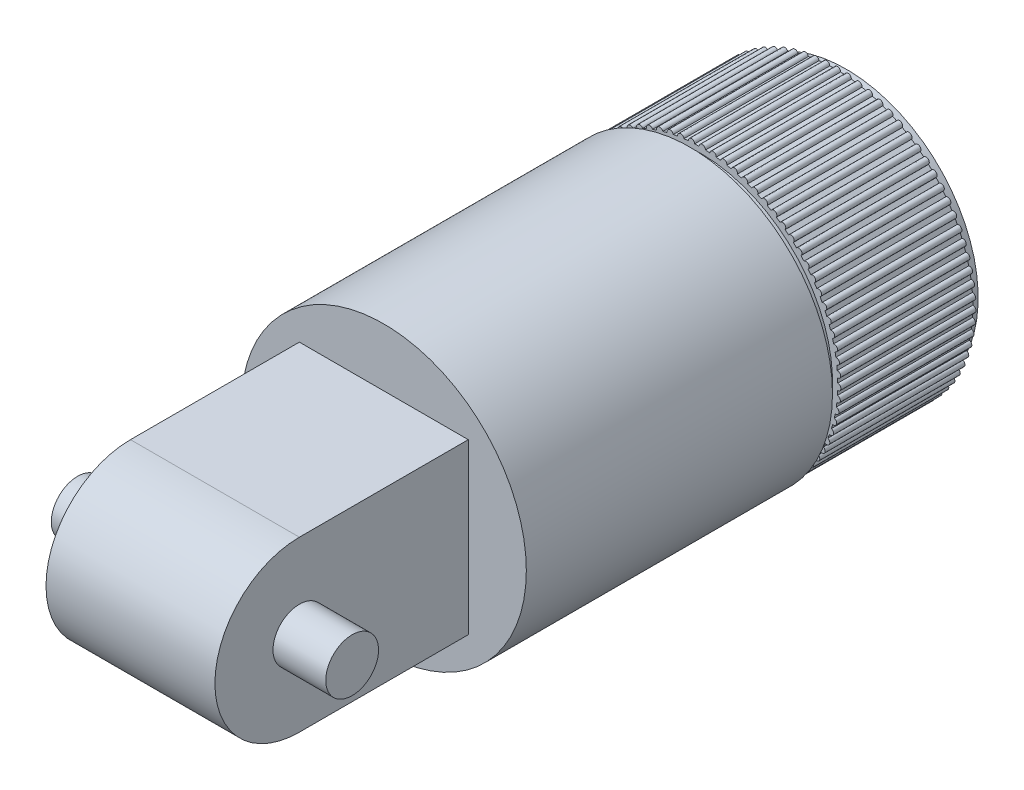
from build123d import *

# Parameters (mm, degrees)
SKETCH1_R                = 3
BOSS_EXTRUDE1_DEPTH      = 6.4
BOSS_EXTRUDE2_DEPTH      = 0.5
BOSS_EXTRUDE2_DEPTH_BACK = 6.9
SKETCH2_R                = 6.25
SKETCH2_R_2              = 3
SKETCH4_R                = 6.75
BOSS_EXTRUDE4_DEPTH      = 14.5
SKETCH5_W                = 8
SKETCH5_H                = 8
BOSS_EXTRUDE5_DEPTH      = 8
BOSS_EXTRUDE6_DEPTH      = 8
BOSS_EXTRUDE7_DEPTH      = 6.5
BOSS_EXTRUDE7_DEPTH_BACK = 6.5
SKETCH8_R                = 1.25


with BuildPart() as part:
    # Sketch1 → Boss-Extrude1 (new body)
    with BuildSketch(Plane.XY):
        with BuildLine():
            ThreePointArc((6.495792492, -0.233837333), (6.649446239, -0.085817886), (6.499663718, 0.066117716))
            ThreePointArc((6.499663718, 0.066117716), (6.497741081, 0.171350078), (6.494114798, 0.276537514))
            ThreePointArc((6.494114798, 0.276537514), (6.63568141, 0.436156201), (6.474439888, 0.575871635))
            ThreePointArc((6.474439888, 0.575871635), (6.464266741, 0.680628752), (6.452398726, 0.785207416))
            ThreePointArc((6.452398726, 0.785207416), (6.581005397, 0.95544124), (6.409298983, 1.082075113))
            ThreePointArc((6.409298983, 1.082075113), (6.390938048, 1.185711124), (6.37090147, 1.289036253))
            ThreePointArc((6.37090147, 1.289036253), (6.485755298, 1.468835666), (6.304642618, 1.581607239))
            ThreePointArc((6.304642618, 1.581607239), (6.278207096, 1.683483193), (6.250125488, 1.784917752))
            ThreePointArc((6.250125488, 1.784917752), (6.350518361, 1.973174231), (6.161116035, 2.071388231))
            ThreePointArc((6.161116035, 2.071388231), (6.12676891, 2.170876027), (6.090815404, 2.269794641))
            ThreePointArc((6.090815404, 2.269794641), (6.176128366, 2.465347522), (5.979604123, 2.548398425))
            ThreePointArc((5.979604123, 2.548398425), (5.937557156, 2.644884689), (5.893953418, 2.74067749))
            ThreePointArc((5.893953418, 2.74067749), (5.963660487, 2.942321125), (5.761225963, 3.009696895))
            ThreePointArc((5.761225963, 3.009696895), (5.711738388, 3.102586758), (5.660753249, 3.194663152))
            ThreePointArc((5.660753249, 3.194663152), (5.714424657, 3.40115434), (5.507327929, 3.452439584))
            ThreePointArc((5.507327929, 3.452439584), (5.450704853, 3.541160347), (5.392652654, 3.628952652))
            ThreePointArc((5.392652654, 3.628952652), (5.429957499, 3.839018307), (5.219475387, 3.873896834))
            ThreePointArc((5.219475387, 3.873896834), (5.15606591, 3.957901506), (5.091304562, 4.040868453))
            ThreePointArc((5.091304562, 4.040868453), (5.112012847, 4.25321345), (4.899443044, 4.271470222))
            ThreePointArc((4.899443044, 4.271470222), (4.829638107, 4.350240885), (4.758566884, 4.427870956))
            ThreePointArc((4.758566884, 4.427870956), (4.762550936, 4.641186118), (4.549204005, 4.642708576))
            ThreePointArc((4.549204005, 4.642708576), (4.473433978, 4.715759583), (4.39649106, 4.787574163))
            ThreePointArc((4.39649106, 4.787574163), (4.383726315, 5.00054433), (4.170917611, 4.985323087))
            ThreePointArc((4.170917611, 4.985323087), (4.089649642, 5.052204054), (4.007309405, 5.117760382))
            ThreePointArc((4.007309405, 5.117760382), (3.977874564, 5.329072523), (3.766916123, 5.297201424))
            ThreePointArc((3.766916123, 5.297201424), (3.680651255, 5.357500008), (3.593421356, 5.416393907))
            ThreePointArc((3.593421356, 5.416393907), (3.547497893, 5.624745212), (3.339690344, 5.576420752))
            ThreePointArc((3.339690344, 5.576420752), (3.24896043, 5.629765193), (3.157378669, 5.681633563))
            ThreePointArc((3.157378669, 5.681633563), (3.095249718, 5.885739477), (2.891874264, 5.821259593))
            ThreePointArc((2.891874264, 5.821259593), (2.797238683, 5.867321003), (2.701869693, 5.911844058))
            ThreePointArc((2.701869693, 5.911844058), (2.623918299, 6.1104462), (2.426228817, 6.030208432))
            ThreePointArc((2.426228817, 6.030208432), (2.328271029, 6.068702828), (2.229702792, 6.105606068))
            ThreePointArc((2.229702792, 6.105606068), (2.136409551, 6.29747999), (1.945624862, 6.201979031))
            ThreePointArc((1.945624862, 6.201979031), (1.844948811, 6.232669082), (1.743789031, 6.261724987))
            ThreePointArc((1.743789031, 6.261724987), (1.635729128, 6.445687723), (1.453025484, 6.335512366))
            ThreePointArc((1.453025484, 6.335512366), (1.350251869, 6.358208859), (1.247124231, 6.379238289))
            ThreePointArc((1.247124231, 6.379238289), (1.124963891, 6.554155647), (0.95146772, 6.429985162))
            ThreePointArc((0.95146772, 6.429985162), (0.847230176, 6.444548163), (0.742770496, 6.457421466))
            ThreePointArc((0.742770496, 6.457421466), (0.607262877, 6.622215022), (0.444043841, 6.48481496))
            ThreePointArc((0.444043841, 6.48481496), (0.338985027, 6.491154686), (0.233837333, 6.495792492))
            ThreePointArc((0.233837333, 6.495792492), (0.085817886, 6.649446239), (-0.066117716, 6.499663718))
            ThreePointArc((-0.066117716, 6.499663718), (-0.171350078, 6.497741081), (-0.276537514, 6.494114798))
            ThreePointArc((-0.276537514, 6.494114798), (-0.436156201, 6.63568141), (-0.575871635, 6.474439888))
            ThreePointArc((-0.575871635, 6.474439888), (-0.680628752, 6.464266741), (-0.785207416, 6.452398726))
            ThreePointArc((-0.785207416, 6.452398726), (-0.95544124, 6.581005397), (-1.082075113, 6.409298983))
            ThreePointArc((-1.082075113, 6.409298983), (-1.185711124, 6.390938048), (-1.289036253, 6.37090147))
            ThreePointArc((-1.289036253, 6.37090147), (-1.468835666, 6.485755298), (-1.581607239, 6.304642618))
            ThreePointArc((-1.581607239, 6.304642618), (-1.683483193, 6.278207096), (-1.784917752, 6.250125488))
            ThreePointArc((-1.784917752, 6.250125488), (-1.973174231, 6.350518361), (-2.071388231, 6.161116035))
            ThreePointArc((-2.071388231, 6.161116035), (-2.170876027, 6.12676891), (-2.269794641, 6.090815404))
            ThreePointArc((-2.269794641, 6.090815404), (-2.465347522, 6.176128366), (-2.548398425, 5.979604123))
            ThreePointArc((-2.548398425, 5.979604123), (-2.644884689, 5.937557156), (-2.74067749, 5.893953418))
            ThreePointArc((-2.74067749, 5.893953418), (-2.942321125, 5.963660487), (-3.009696895, 5.761225963))
            ThreePointArc((-3.009696895, 5.761225963), (-3.102586758, 5.711738388), (-3.194663152, 5.660753249))
            ThreePointArc((-3.194663152, 5.660753249), (-3.40115434, 5.714424657), (-3.452439584, 5.507327929))
            ThreePointArc((-3.452439584, 5.507327929), (-3.541160347, 5.450704853), (-3.628952652, 5.392652654))
            ThreePointArc((-3.628952652, 5.392652654), (-3.839018307, 5.429957499), (-3.873896834, 5.219475387))
            ThreePointArc((-3.873896834, 5.219475387), (-3.957901506, 5.15606591), (-4.040868453, 5.091304562))
            ThreePointArc((-4.040868453, 5.091304562), (-4.25321345, 5.112012847), (-4.271470222, 4.899443044))
            ThreePointArc((-4.271470222, 4.899443044), (-4.350240885, 4.829638107), (-4.427870956, 4.758566884))
            ThreePointArc((-4.427870956, 4.758566884), (-4.641186118, 4.762550936), (-4.642708576, 4.549204005))
            ThreePointArc((-4.642708576, 4.549204005), (-4.715759583, 4.473433978), (-4.787574163, 4.39649106))
            ThreePointArc((-4.787574163, 4.39649106), (-5.00054433, 4.383726315), (-4.985323087, 4.170917611))
            ThreePointArc((-4.985323087, 4.170917611), (-5.052204054, 4.089649642), (-5.117760382, 4.007309405))
            ThreePointArc((-5.117760382, 4.007309405), (-5.329072523, 3.977874564), (-5.297201424, 3.766916123))
            ThreePointArc((-5.297201424, 3.766916123), (-5.357500008, 3.680651255), (-5.416393907, 3.593421356))
            ThreePointArc((-5.416393907, 3.593421356), (-5.624745212, 3.547497893), (-5.576420752, 3.339690344))
            ThreePointArc((-5.576420752, 3.339690344), (-5.629765193, 3.24896043), (-5.681633563, 3.157378669))
            ThreePointArc((-5.681633563, 3.157378669), (-5.885739477, 3.095249718), (-5.821259593, 2.891874264))
            ThreePointArc((-5.821259593, 2.891874264), (-5.867321003, 2.797238683), (-5.911844058, 2.701869693))
            ThreePointArc((-5.911844058, 2.701869693), (-6.1104462, 2.623918299), (-6.030208432, 2.426228817))
            ThreePointArc((-6.030208432, 2.426228817), (-6.068702828, 2.328271029), (-6.105606068, 2.229702792))
            ThreePointArc((-6.105606068, 2.229702792), (-6.29747999, 2.136409551), (-6.201979031, 1.945624862))
            ThreePointArc((-6.201979031, 1.945624862), (-6.232669082, 1.844948811), (-6.261724987, 1.743789031))
            ThreePointArc((-6.261724987, 1.743789031), (-6.445687723, 1.635729128), (-6.335512366, 1.453025484))
            ThreePointArc((-6.335512366, 1.453025484), (-6.358208859, 1.350251869), (-6.379238289, 1.247124231))
            ThreePointArc((-6.379238289, 1.247124231), (-6.554155647, 1.124963891), (-6.429985162, 0.95146772))
            ThreePointArc((-6.429985162, 0.95146772), (-6.444548163, 0.847230176), (-6.457421466, 0.742770496))
            ThreePointArc((-6.457421466, 0.742770496), (-6.622215022, 0.607262877), (-6.48481496, 0.444043841))
            ThreePointArc((-6.48481496, 0.444043841), (-6.491154686, 0.338985027), (-6.495792492, 0.233837333))
            ThreePointArc((-6.495792492, 0.233837333), (-6.649446239, 0.085817886), (-6.499663718, -0.066117716))
            ThreePointArc((-6.499663718, -0.066117716), (-6.497741081, -0.171350078), (-6.494114798, -0.276537514))
            ThreePointArc((-6.494114798, -0.276537514), (-6.63568141, -0.436156201), (-6.474439888, -0.575871635))
            ThreePointArc((-6.474439888, -0.575871635), (-6.464266741, -0.680628752), (-6.452398726, -0.785207416))
            ThreePointArc((-6.452398726, -0.785207416), (-6.581005397, -0.95544124), (-6.409298983, -1.082075113))
            ThreePointArc((-6.409298983, -1.082075113), (-6.390938048, -1.185711124), (-6.37090147, -1.289036253))
            ThreePointArc((-6.37090147, -1.289036253), (-6.485755298, -1.468835666), (-6.304642618, -1.581607239))
            ThreePointArc((-6.304642618, -1.581607239), (-6.278207096, -1.683483193), (-6.250125488, -1.784917752))
            ThreePointArc((-6.250125488, -1.784917752), (-6.350518361, -1.973174231), (-6.161116035, -2.071388231))
            ThreePointArc((-6.161116035, -2.071388231), (-6.12676891, -2.170876027), (-6.090815404, -2.269794641))
            ThreePointArc((-6.090815404, -2.269794641), (-6.176128366, -2.465347522), (-5.979604123, -2.548398425))
            ThreePointArc((-5.979604123, -2.548398425), (-5.937557156, -2.644884689), (-5.893953418, -2.74067749))
            ThreePointArc((-5.893953418, -2.74067749), (-5.963660487, -2.942321125), (-5.761225963, -3.009696895))
            ThreePointArc((-5.761225963, -3.009696895), (-5.711738388, -3.102586758), (-5.660753249, -3.194663152))
            ThreePointArc((-5.660753249, -3.194663152), (-5.714424657, -3.40115434), (-5.507327929, -3.452439584))
            ThreePointArc((-5.507327929, -3.452439584), (-5.450704853, -3.541160347), (-5.392652654, -3.628952652))
            ThreePointArc((-5.392652654, -3.628952652), (-5.429957499, -3.839018307), (-5.219475387, -3.873896834))
            ThreePointArc((-5.219475387, -3.873896834), (-5.15606591, -3.957901506), (-5.091304562, -4.040868453))
            ThreePointArc((-5.091304562, -4.040868453), (-5.112012847, -4.25321345), (-4.899443044, -4.271470222))
            ThreePointArc((-4.899443044, -4.271470222), (-4.829638107, -4.350240885), (-4.758566884, -4.427870956))
            ThreePointArc((-4.758566884, -4.427870956), (-4.762550936, -4.641186118), (-4.549204005, -4.642708576))
            ThreePointArc((-4.549204005, -4.642708576), (-4.473433978, -4.715759583), (-4.39649106, -4.787574163))
            ThreePointArc((-4.39649106, -4.787574163), (-4.383726315, -5.00054433), (-4.170917611, -4.985323087))
            ThreePointArc((-4.170917611, -4.985323087), (-4.089649642, -5.052204054), (-4.007309405, -5.117760382))
            ThreePointArc((-4.007309405, -5.117760382), (-3.977874564, -5.329072523), (-3.766916123, -5.297201424))
            ThreePointArc((-3.766916123, -5.297201424), (-3.680651255, -5.357500008), (-3.593421356, -5.416393907))
            ThreePointArc((-3.593421356, -5.416393907), (-3.547497893, -5.624745212), (-3.339690344, -5.576420752))
            ThreePointArc((-3.339690344, -5.576420752), (-3.24896043, -5.629765193), (-3.157378669, -5.681633563))
            ThreePointArc((-3.157378669, -5.681633563), (-3.095249718, -5.885739477), (-2.891874264, -5.821259593))
            ThreePointArc((-2.891874264, -5.821259593), (-2.797238683, -5.867321003), (-2.701869693, -5.911844058))
            ThreePointArc((-2.701869693, -5.911844058), (-2.623918299, -6.1104462), (-2.426228817, -6.030208432))
            ThreePointArc((-2.426228817, -6.030208432), (-2.328271029, -6.068702828), (-2.229702792, -6.105606068))
            ThreePointArc((-2.229702792, -6.105606068), (-2.136409551, -6.29747999), (-1.945624862, -6.201979031))
            ThreePointArc((-1.945624862, -6.201979031), (-1.844948811, -6.232669082), (-1.743789031, -6.261724987))
            ThreePointArc((-1.743789031, -6.261724987), (-1.635729128, -6.445687723), (-1.453025484, -6.335512366))
            ThreePointArc((-1.453025484, -6.335512366), (-1.350251869, -6.358208859), (-1.247124231, -6.379238289))
            ThreePointArc((-1.247124231, -6.379238289), (-1.124963891, -6.554155647), (-0.95146772, -6.429985162))
            ThreePointArc((-0.95146772, -6.429985162), (-0.847230176, -6.444548163), (-0.742770496, -6.457421466))
            ThreePointArc((-0.742770496, -6.457421466), (-0.607262877, -6.622215022), (-0.444043841, -6.48481496))
            ThreePointArc((-0.444043841, -6.48481496), (-0.338985027, -6.491154686), (-0.233837333, -6.495792492))
            ThreePointArc((-0.233837333, -6.495792492), (-0.085817886, -6.649446239), (0.066117716, -6.499663718))
            ThreePointArc((0.066117716, -6.499663718), (0.171350078, -6.497741081), (0.276537514, -6.494114798))
            ThreePointArc((0.276537514, -6.494114798), (0.436156201, -6.63568141), (0.575871635, -6.474439888))
            ThreePointArc((0.575871635, -6.474439888), (0.680628752, -6.464266741), (0.785207416, -6.452398726))
            ThreePointArc((0.785207416, -6.452398726), (0.95544124, -6.581005397), (1.082075113, -6.409298983))
            ThreePointArc((1.082075113, -6.409298983), (1.185711124, -6.390938048), (1.289036253, -6.37090147))
            ThreePointArc((1.289036253, -6.37090147), (1.468835666, -6.485755298), (1.581607239, -6.304642618))
            ThreePointArc((1.581607239, -6.304642618), (1.683483193, -6.278207096), (1.784917752, -6.250125488))
            ThreePointArc((1.784917752, -6.250125488), (1.973174231, -6.350518361), (2.071388231, -6.161116035))
            ThreePointArc((2.071388231, -6.161116035), (2.170876027, -6.12676891), (2.269794641, -6.090815404))
            ThreePointArc((2.269794641, -6.090815404), (2.465347522, -6.176128366), (2.548398425, -5.979604123))
            ThreePointArc((2.548398425, -5.979604123), (2.644884689, -5.937557156), (2.74067749, -5.893953418))
            ThreePointArc((2.74067749, -5.893953418), (2.942321125, -5.963660487), (3.009696895, -5.761225963))
            ThreePointArc((3.009696895, -5.761225963), (3.102586758, -5.711738388), (3.194663152, -5.660753249))
            ThreePointArc((3.194663152, -5.660753249), (3.40115434, -5.714424657), (3.452439584, -5.507327929))
            ThreePointArc((3.452439584, -5.507327929), (3.541160347, -5.450704853), (3.628952652, -5.392652654))
            ThreePointArc((3.628952652, -5.392652654), (3.839018307, -5.429957499), (3.873896834, -5.219475387))
            ThreePointArc((3.873896834, -5.219475387), (3.957901506, -5.15606591), (4.040868453, -5.091304562))
            ThreePointArc((4.040868453, -5.091304562), (4.25321345, -5.112012847), (4.271470222, -4.899443044))
            ThreePointArc((4.271470222, -4.899443044), (4.350240885, -4.829638107), (4.427870956, -4.758566884))
            ThreePointArc((4.427870956, -4.758566884), (4.641186118, -4.762550936), (4.642708576, -4.549204005))
            ThreePointArc((4.642708576, -4.549204005), (4.715759583, -4.473433978), (4.787574163, -4.39649106))
            ThreePointArc((4.787574163, -4.39649106), (5.00054433, -4.383726315), (4.985323087, -4.170917611))
            ThreePointArc((4.985323087, -4.170917611), (5.052204054, -4.089649642), (5.117760382, -4.007309405))
            ThreePointArc((5.117760382, -4.007309405), (5.329072523, -3.977874564), (5.297201424, -3.766916123))
            ThreePointArc((5.297201424, -3.766916123), (5.357500008, -3.680651255), (5.416393907, -3.593421356))
            ThreePointArc((5.416393907, -3.593421356), (5.624745212, -3.547497893), (5.576420752, -3.339690344))
            ThreePointArc((5.576420752, -3.339690344), (5.629765193, -3.24896043), (5.681633563, -3.157378669))
            ThreePointArc((5.681633563, -3.157378669), (5.885739477, -3.095249718), (5.821259593, -2.891874264))
            ThreePointArc((5.821259593, -2.891874264), (5.867321003, -2.797238683), (5.911844058, -2.701869693))
            ThreePointArc((5.911844058, -2.701869693), (6.1104462, -2.623918299), (6.030208432, -2.426228817))
            ThreePointArc((6.030208432, -2.426228817), (6.068702828, -2.328271029), (6.105606068, -2.229702792))
            ThreePointArc((6.105606068, -2.229702792), (6.29747999, -2.136409551), (6.201979031, -1.945624862))
            ThreePointArc((6.201979031, -1.945624862), (6.232669082, -1.844948811), (6.261724987, -1.743789031))
            ThreePointArc((6.261724987, -1.743789031), (6.445687723, -1.635729128), (6.335512366, -1.453025484))
            ThreePointArc((6.335512366, -1.453025484), (6.358208859, -1.350251869), (6.379238289, -1.247124231))
            ThreePointArc((6.379238289, -1.247124231), (6.554155647, -1.124963891), (6.429985162, -0.95146772))
            ThreePointArc((6.429985162, -0.95146772), (6.444548163, -0.847230176), (6.457421466, -0.742770496))
            ThreePointArc((6.457421466, -0.742770496), (6.622215022, -0.607262877), (6.48481496, -0.444043841))
            ThreePointArc((6.48481496, -0.444043841), (6.491154686, -0.338985027), (6.495792492, -0.233837333))
        make_face()
        Circle(SKETCH1_R, mode=Mode.SUBTRACT)
    extrude(amount=BOSS_EXTRUDE1_DEPTH)

    # Sketch2 → Boss-Extrude2 (add, two sides: drawn at the far end of the back side and taken through both)
    with BuildSketch(Plane(origin=(0, 0, 0), x_dir=(-1, 0, 0), z_dir=(0, 0, -1)).offset(-BOSS_EXTRUDE2_DEPTH_BACK)):
        Circle(SKETCH2_R)
        Circle(SKETCH2_R_2, mode=Mode.SUBTRACT)
    extrude(amount=BOSS_EXTRUDE2_DEPTH + BOSS_EXTRUDE2_DEPTH_BACK)

    # Sketch4 → Boss-Extrude4 (add)
    with BuildSketch(Plane.XY.offset(6.9)):
        with Locations(Location((0, 0, 0), (0, 0, 180))):
            Circle(SKETCH4_R)
    extrude(amount=BOSS_EXTRUDE4_DEPTH)

    # Sketch5 → Boss-Extrude5 (add)
    with BuildSketch(Plane.XY.offset(21.4)):
        Rectangle(SKETCH5_W, SKETCH5_H)
    extrude(amount=BOSS_EXTRUDE5_DEPTH)

    # Sketch6 → Boss-Extrude6 (add)
    with BuildSketch(Plane.ZY.offset(4)):
        with BuildLine():
            Line((29.4, 4), (29.4, -4))
            ThreePointArc((29.4, -4), (33.4, 0), (29.4, 4))
        make_face()
    extrude(amount=-BOSS_EXTRUDE6_DEPTH)

    # Sketch8 → Boss-Extrude7 (add, two sides: drawn at the far end of the back side and taken through both)
    with BuildSketch(Plane(origin=(0, 0, 0), x_dir=(0, 0, -1), z_dir=(1, 0, 0)).offset(-BOSS_EXTRUDE7_DEPTH_BACK)):
        with Locations((-29.4, 0)):
            Circle(SKETCH8_R)
    extrude(amount=BOSS_EXTRUDE7_DEPTH + BOSS_EXTRUDE7_DEPTH_BACK)


solid = part.part
